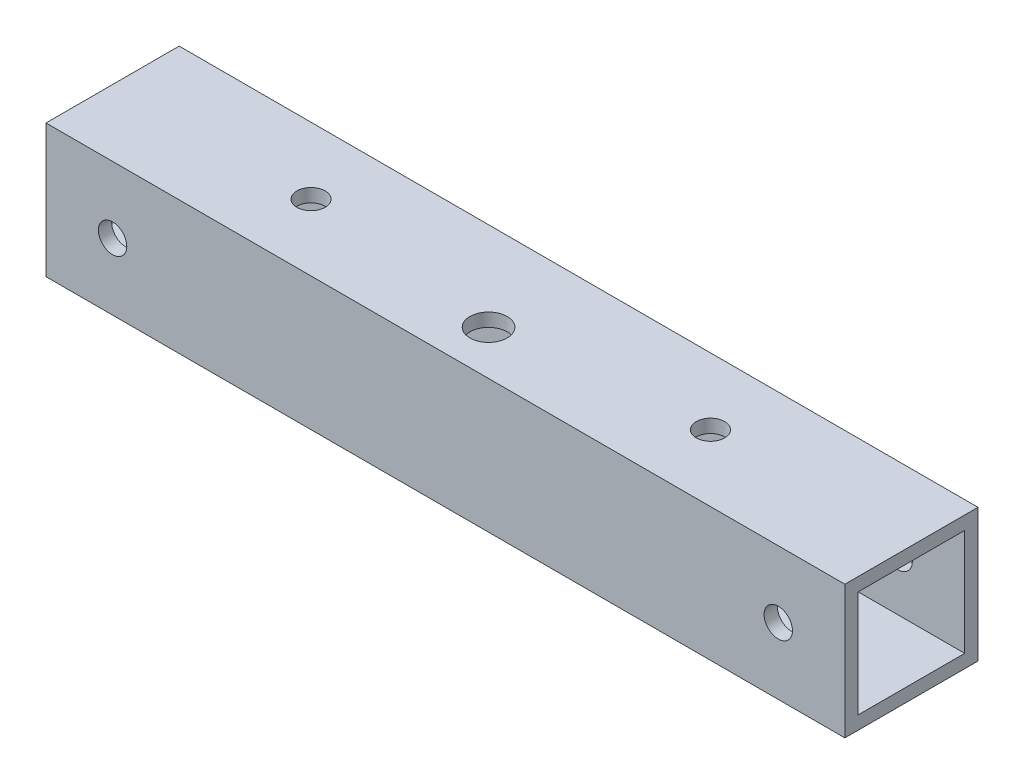
from build123d import *

# Parameters (mm, degrees)
SKETCH_1_W          = 15
SKETCH_1_H          = 15
SKETCH_1_W_2        = 12
SKETCH_1_H_2        = 12
EXTRUDE_1_DEPTH     = 90
SKETCH_2_R          = 2.1
SKETCH_2_R_2        = 1.6
CUT_EXTRUDE_1_DEPTH = 92.549167118
SKETCH_3_R          = 1.6
CUT_EXTRUDE_2_DEPTH = 92.549167118


with BuildPart() as part:
    # ｽｹｯﾁ1 → ﾎﾞｽ - 押し出し1 (new body)
    with BuildSketch(Plane(origin=(0, 0, 0), x_dir=(0, 0, -1), z_dir=(1, 0, 0))):
        Rectangle(SKETCH_1_W, SKETCH_1_H)
        Rectangle(SKETCH_1_W_2, SKETCH_1_H_2, mode=Mode.SUBTRACT)
    extrude(amount=EXTRUDE_1_DEPTH)

    # ｽｹｯﾁ2 → ｶｯﾄ - 押し出し1 (cut, through all)
    with BuildSketch(Plane(origin=(0, 7.5, 0), x_dir=(1, 0, 0), z_dir=(0, 1, 0))):
        with Locations(Location((44.860461956, -2.501947466, 0), (0, 0, 270))):
            Circle(SKETCH_2_R)
        with Locations(Location((22.360461956, 0, 0), (0, 0, 270))):
            Circle(SKETCH_2_R_2)
        with Locations(Location((67.360461956, 0, 0), (0, 0, 270))):
            Circle(SKETCH_2_R_2)
    extrude(amount=-CUT_EXTRUDE_1_DEPTH, mode=Mode.SUBTRACT)

    # ｽｹｯﾁ3 → ｶｯﾄ - 押し出し2 (cut, through all)
    with BuildSketch(Plane.XY.offset(7.5)):
        with Locations((7.5, 0)):
            Circle(SKETCH_3_R)
        with Locations((82.5, 0)):
            Circle(SKETCH_3_R)
    extrude(amount=-CUT_EXTRUDE_2_DEPTH, mode=Mode.SUBTRACT)


solid = part.part
